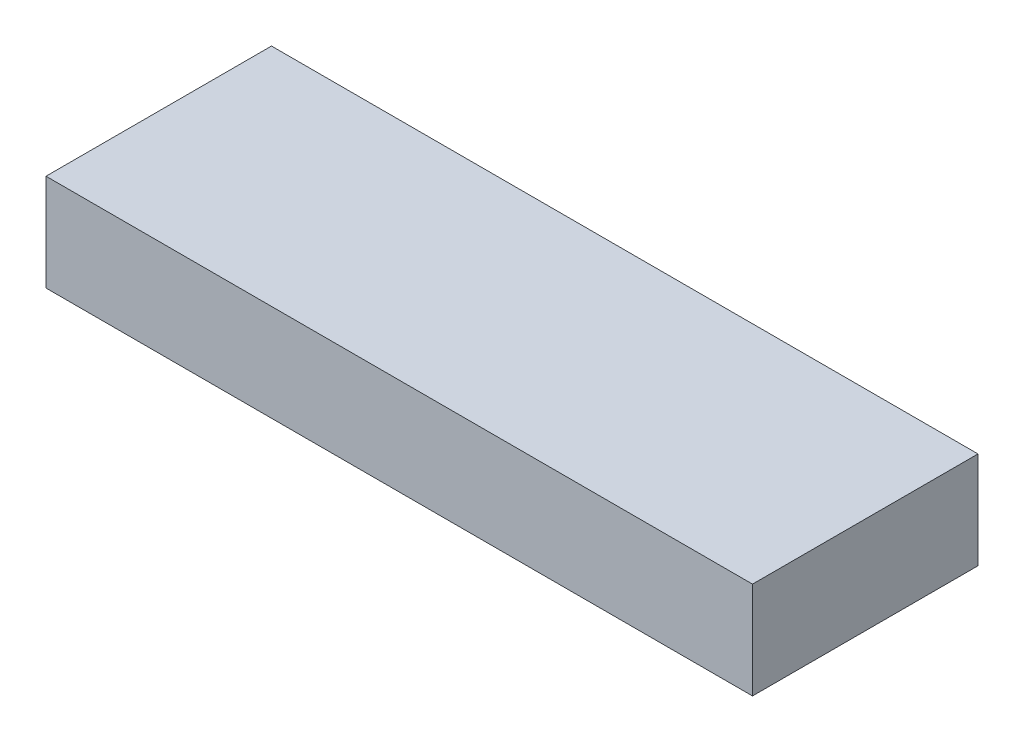
from build123d import *

# Parameters (mm, degrees)
SKETCH1_W           = 106.3244
SKETCH1_H           = 33.9344
BOSS_EXTRUDE1_DEPTH = 14.5796


with BuildPart() as part:
    # Sketch1 → Boss-Extrude1 (new body)
    with BuildSketch(Plane(origin=(0, 0, 0), x_dir=(1, 0, 0), z_dir=(0, 1, 0))):
        with Locations((53.1622, 16.9672)):
            Rectangle(SKETCH1_W, SKETCH1_H)
    extrude(amount=BOSS_EXTRUDE1_DEPTH)


solid = part.part
